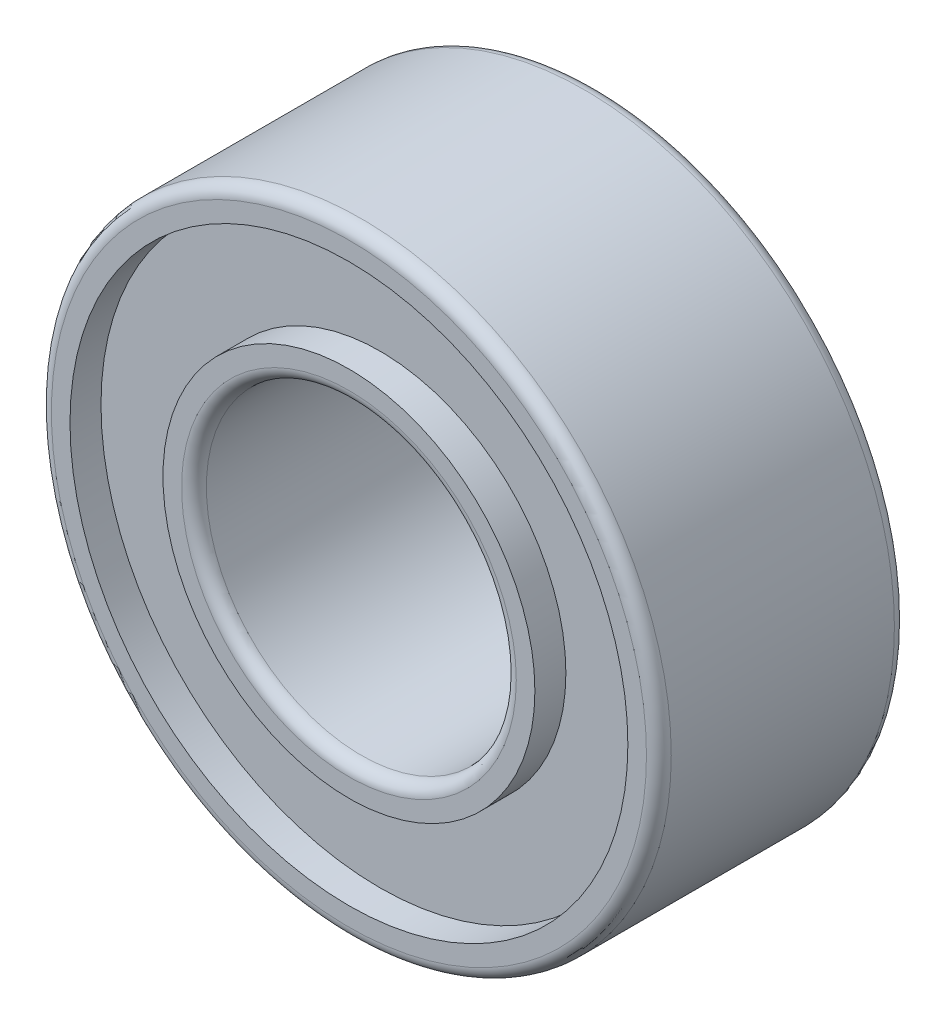
from build123d import *

# Parameters (mm, degrees)
SKIZZE1_R                       = 5
SKIZZE1_R_2                     = 2.5
AUFSATZ_LINEAR_AUSTRAGEN1_DEPTH = 4
VERRUNDUNG1_R                   = 0.2
SKIZZE2_R                       = 4.5
SKIZZE2_R_2                     = 3
SCHNITT_LINEAR_AUSTRAGEN1_DEPTH = 0.5
SCHNITT_LINEAR_START            = -0.5
SKIZZE3_R                       = 4.5
SKIZZE3_R_2                     = 3
SCHNITT_LINEAR_AUSTRAGEN2_DEPTH = 0.5


with BuildPart() as part:
    # Skizze1 → Aufsatz-Linear austragen1 (new body)
    with BuildSketch(Plane.XY):
        Circle(SKIZZE1_R)
        Circle(SKIZZE1_R_2, mode=Mode.SUBTRACT)
    extrude(amount=AUFSATZ_LINEAR_AUSTRAGEN1_DEPTH)

    # Verrundung1
    verrundung1_edges = [part.edges().sort_by_distance(p)[0] for p in [
        (-5, 0, 0),
        (-5, 0, 4),
        (-2.5, 0, 0),
        (-2.5, 0, 4),
    ]]
    fillet(verrundung1_edges, radius=VERRUNDUNG1_R)

    # Skizze2 → Schnitt-Linear austragen1 (cut)
    with BuildSketch(Plane(origin=(0, 0, 0), x_dir=(-1, 0, 0), z_dir=(0, 0, -1))):
        Circle(SKIZZE2_R)
        Circle(SKIZZE2_R_2, mode=Mode.SUBTRACT)
    extrude(amount=-SCHNITT_LINEAR_AUSTRAGEN1_DEPTH, mode=Mode.SUBTRACT)

    # Skizze3 → Schnitt-Linear austragen2 (cut)
    with BuildSketch(Plane.XY.offset(4).offset(SCHNITT_LINEAR_START)):
        with Locations(Location((0, 0, 0), (0, 0, 180))):
            Circle(SKIZZE3_R)
        with Locations(Location((0, 0, 0), (0, 0, 180))):
            Circle(SKIZZE3_R_2, mode=Mode.SUBTRACT)
    extrude(amount=SCHNITT_LINEAR_AUSTRAGEN2_DEPTH, mode=Mode.SUBTRACT)


solid = part.part
